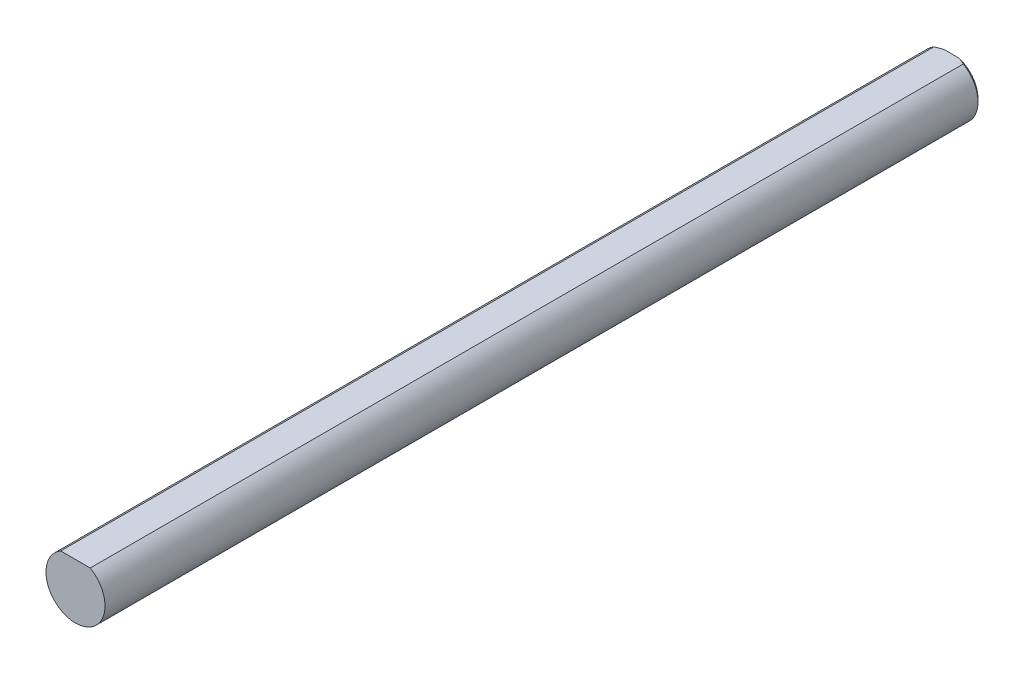
from build123d import *

# Parameters (mm, degrees)
BOSS_EXTRUDE2_DEPTH      = 76.2
BOSS_EXTRUDE2_DEPTH_BACK = 76.2
SKETCH3_R                = 3.175
CUT_EXTRUDE5_DEPTH       = 77.332177029
CUT_EXTRUDE5_DEPTH_BACK  = 77.332177029
CHAMFER1_SIZE            = 0.3175
SKETCH11_W               = 9.577733326
SKETCH11_H               = 8.205515822
CUT_EXTRUDE6_DEPTH       = 58.2


with BuildPart() as part:
    # Sketch3 → Boss-Extrude2 (new, two sides: drawn at the far end of the back side and taken through both)
    with BuildSketch(Plane.XY.offset(-BOSS_EXTRUDE2_DEPTH_BACK)):
        with Locations(Location((0, 0, 0), (0, 0, 180))):
            Circle(SKETCH3_R)
    extrude(amount=BOSS_EXTRUDE2_DEPTH + BOSS_EXTRUDE2_DEPTH_BACK)

    # Sketch10 → Cut-Extrude5 (cut, two sides: drawn at the far end of the back side and taken through both)
    with BuildSketch(Plane.XY.offset(-CUT_EXTRUDE5_DEPTH_BACK)):
        with BuildLine():
            Line((-1.5875, 2.749630657), (1.5875, 2.749630657))
            ThreePointArc((1.5875, 2.749630657), (0, 3.175), (-1.5875, 2.749630657))
        make_face()
    extrude(amount=CUT_EXTRUDE5_DEPTH + CUT_EXTRUDE5_DEPTH_BACK, mode=Mode.SUBTRACT)

    # Chamfer1
    chamfer1_edges = [part.edges().sort_by_distance(p)[0] for p in [
        (0, -3.175, -76.2),
        (0, -3.175, 76.2),
    ]]
    chamfer(chamfer1_edges, length=CHAMFER1_SIZE)

    # Sketch11 → Cut-Extrude6 (cut)
    with BuildSketch(Plane.XY.offset(76.2)):
        Rectangle(SKETCH11_W, SKETCH11_H)
    extrude(amount=-CUT_EXTRUDE6_DEPTH, mode=Mode.SUBTRACT)


solid = part.part
